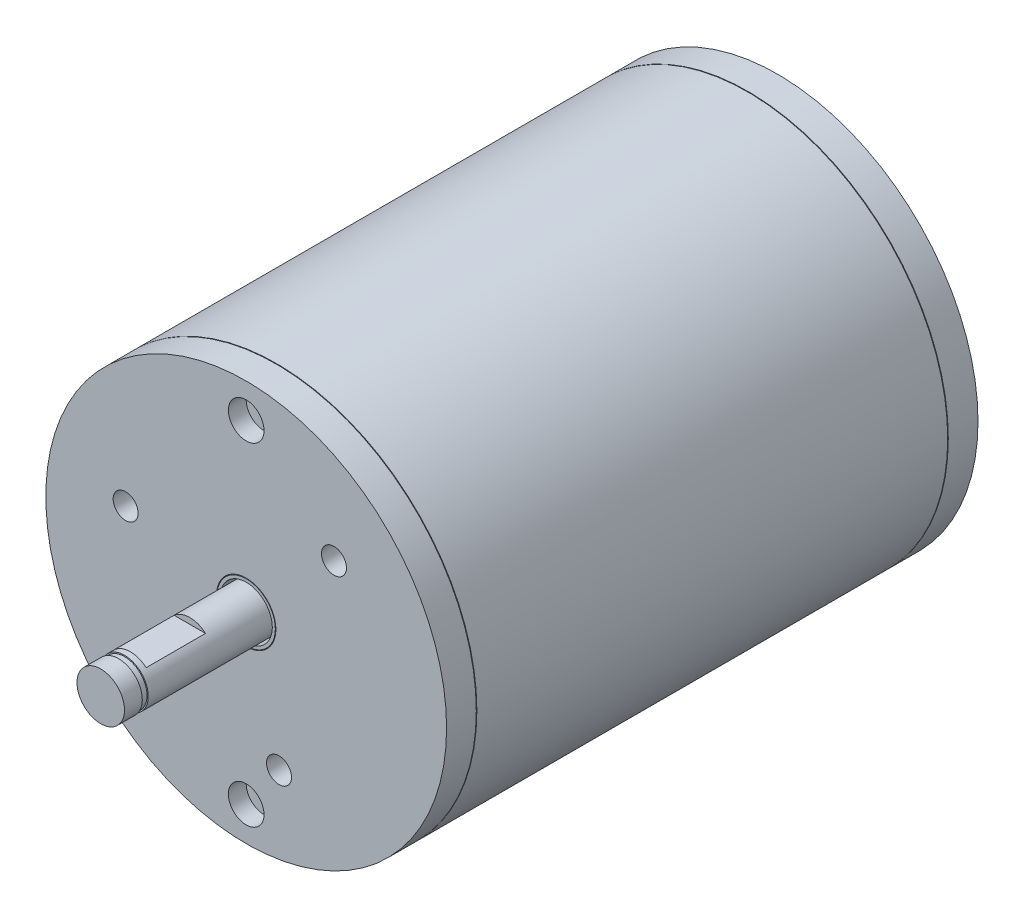
from build123d import *

# Parameters (mm, degrees)
SKETCH1_R             = 33.75
BOSS_EXTRUDE1_DEPTH   = 5
SKETCH2_R             = 33.6
BOSS_EXTRUDE2_DEPTH   = 0.1
SKETCH3_R             = 33.75
BOSS_EXTRUDE3_DEPTH   = 79.3
SKETCH4_R             = 33.6
BOSS_EXTRUDE4_DEPTH   = 0.1
SKETCH5_R             = 33.75
BOSS_EXTRUDE5_DEPTH   = 5
SKETCH6_R             = 5
CUT_EXTRUDE1_DEPTH    = 5
SKETCH7_R             = 4.9
SKETCH7_R_2           = 4.4
BOSS_EXTRUDE6_DEPTH   = 5
SKETCH8_R             = 4
BOSS_EXTRUDE7_DEPTH   = 24.5
SKETCH9_R             = 15
BOSS_EXTRUDE8_DEPTH   = 9.91
M5_TAPPED_HOLE1_D     = 4.2
M5_TAPPED_HOLE1_DEPTH = 5
M5_TAPPED_HOLE1_TIP   = 1.2618073
SKETCH12_W            = 8
SKETCH12_H            = 10
CUT_EXTRUDE2_DEPTH    = 1
SKETCH13_R            = 4
BOSS_EXTRUDE9_DEPTH   = 1
SKETCH14_R            = 3.8
BOSS_EXTRUDE10_DEPTH  = 1
SKETCH15_R            = 4
BOSS_EXTRUDE11_DEPTH  = 3
SKETCH16_R            = 3
CUT_EXTRUDE3_DEPTH    = 3


with BuildPart() as part:
    # Sketch1 → Boss-Extrude1 (new body)
    with BuildSketch(Plane.XY):
        Circle(SKETCH1_R)
    extrude(amount=BOSS_EXTRUDE1_DEPTH)

    # Sketch2 → Boss-Extrude2 (add)
    with BuildSketch(Plane.XY.offset(5)):
        Circle(SKETCH2_R)
    extrude(amount=BOSS_EXTRUDE2_DEPTH)

    # Sketch3 → Boss-Extrude3 (add)
    with BuildSketch(Plane.XY.offset(5.1)):
        Circle(SKETCH3_R)
    extrude(amount=BOSS_EXTRUDE3_DEPTH)

    # Sketch4 → Boss-Extrude4 (add)
    with BuildSketch(Plane.XY.offset(84.4)):
        Circle(SKETCH4_R)
    extrude(amount=BOSS_EXTRUDE4_DEPTH)

    # Sketch5 → Boss-Extrude5 (add)
    with BuildSketch(Plane.XY.offset(84.5)):
        Circle(SKETCH5_R)
    extrude(amount=BOSS_EXTRUDE5_DEPTH)

    # Sketch6 → Cut-Extrude1 (cut)
    with BuildSketch(Plane.XY.offset(89.5)):
        Circle(SKETCH6_R)
    extrude(amount=-CUT_EXTRUDE1_DEPTH, mode=Mode.SUBTRACT)

    # Sketch7 → Boss-Extrude6 (add)
    with BuildSketch(Plane.XY.offset(84.5)):
        Circle(SKETCH7_R)
        Circle(SKETCH7_R_2, mode=Mode.SUBTRACT)
    extrude(amount=BOSS_EXTRUDE6_DEPTH)

    # Sketch8 → Boss-Extrude7 (add)
    with BuildSketch(Plane.XY.offset(84.5)):
        Circle(SKETCH8_R)
    extrude(amount=BOSS_EXTRUDE7_DEPTH)

    # Sketch9 → Boss-Extrude8 (add)
    with BuildSketch(Plane(origin=(0, 0, 0), x_dir=(-1, 0, 0), z_dir=(0, 0, -1))):
        Circle(SKETCH9_R)
    extrude(amount=BOSS_EXTRUDE8_DEPTH)

    # M5 Tapped Hole1
    with Locations(Plane(origin=(-20.308390576, 5.345023126, 89.5), x_dir=(1, 0, 0), z_dir=(0, 0, 1))):
        with Locations((0, 0), (35.091511675, 9.57004746), (25.833660053, -25.605116838)):
            Hole(M5_TAPPED_HOLE1_D / 2, depth=M5_TAPPED_HOLE1_DEPTH)
            with Locations((0, 0, -(M5_TAPPED_HOLE1_DEPTH + M5_TAPPED_HOLE1_TIP / 2))):  # 118° drill point
                Cone(0, M5_TAPPED_HOLE1_D / 2, M5_TAPPED_HOLE1_TIP, mode=Mode.SUBTRACT)

    # Sketch12 → Cut-Extrude2 (cut)
    with BuildSketch(Plane(origin=(0, 4, 0), x_dir=(1, 0, 0), z_dir=(0, 1, 0))):
        with Locations((0, -104)):
            Rectangle(SKETCH12_W, SKETCH12_H)
    extrude(amount=-CUT_EXTRUDE2_DEPTH, mode=Mode.SUBTRACT)

    # Sketch13 → Boss-Extrude9 (add)
    with BuildSketch(Plane.XY.offset(109)):
        Circle(SKETCH13_R)
    extrude(amount=BOSS_EXTRUDE9_DEPTH)

    # Sketch14 → Boss-Extrude10 (add)
    with BuildSketch(Plane.XY.offset(110)):
        Circle(SKETCH14_R)
    extrude(amount=BOSS_EXTRUDE10_DEPTH)

    # Sketch15 → Boss-Extrude11 (add)
    with BuildSketch(Plane.XY.offset(111)):
        Circle(SKETCH15_R)
    extrude(amount=BOSS_EXTRUDE11_DEPTH)

    # Sketch16 → Cut-Extrude3 (cut)
    with BuildSketch(Plane.XY.offset(89.5)):
        with Locations((0, 28)):
            Circle(SKETCH16_R)
        with Locations((0, -28)):
            Circle(SKETCH16_R)
    extrude(amount=-CUT_EXTRUDE3_DEPTH, mode=Mode.SUBTRACT)


solid = part.part
